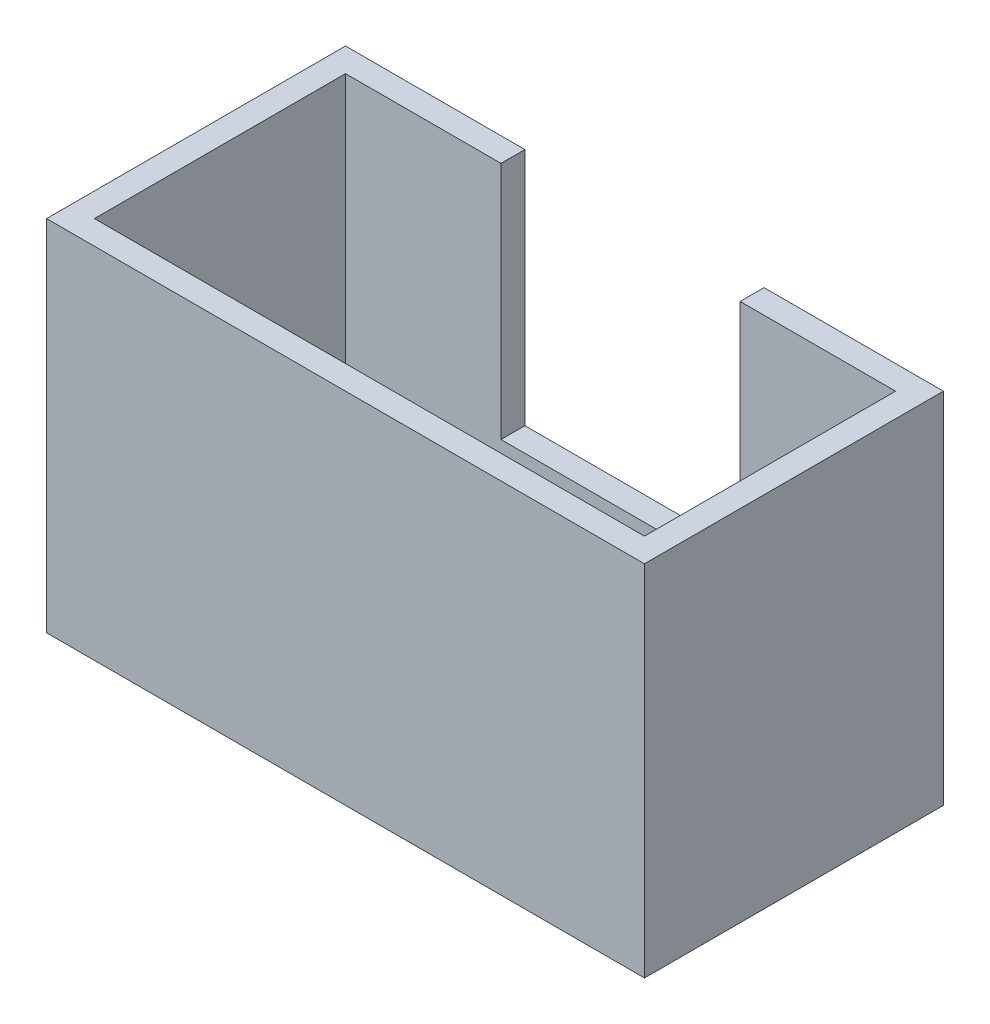
from build123d import *

# Parameters (mm, degrees)
SKETCH_1_W          = 10
SKETCH_1_H          = 6
EXTRUDE_1_DEPTH     = 5
SHELL_1_T           = -0.4
CUT_EXTRUDE_1_REACH = 14.689
SKETCH_2_W          = 4
SKETCH_2_H          = 4


with BuildPart() as part:
    # 草图1 → 凸台-拉伸1 (new body)
    with BuildSketch(Plane.XY):
        with Locations((5, 3)):
            Rectangle(SKETCH_1_W, SKETCH_1_H)
    extrude(amount=EXTRUDE_1_DEPTH)

    # 抽壳1
    shell_1_openings = [part.faces().sort_by_distance(p)[0] for p in [
        (5, 6, 2.5),
    ]]
    offset(amount=SHELL_1_T, openings=shell_1_openings, kind=Kind.INTERSECTION)

    # 草图2 → 切除-拉伸1 (cut, up to next)
    with BuildSketch(Plane(origin=(0, 0, 0), x_dir=(-1, 0, 0), z_dir=(0, 0, -1)), mode=Mode.PRIVATE) as cut_extrude_1_sk1:
        with Locations((-5, 4)):
            Rectangle(SKETCH_2_W, SKETCH_2_H)
    cut_extrude_1_tool1 = extrude(cut_extrude_1_sk1.sketch, amount=-CUT_EXTRUDE_1_REACH, mode=Mode.PRIVATE) & part.part
    add(cut_extrude_1_tool1.solids().sort_by_distance((5, 4, 0))[0], mode=Mode.SUBTRACT)


solid = part.part
